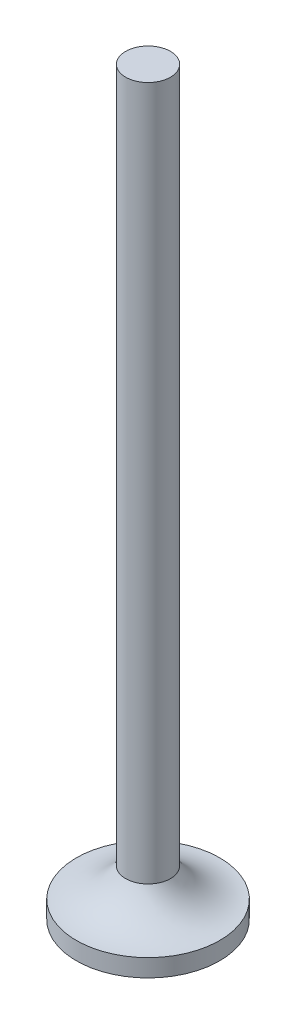
from build123d import *


with BuildPart() as part:
    # Sketch1 → Revolve1 (revolve)
    with BuildSketch(Plane.XY, mode=Mode.PRIVATE) as revolve1_sk:
        with BuildLine():
            Line((0, 0), (10.16, 0))
            Line((10.16, 0), (10.16, 2.5))
            ThreePointArc((10.16, 2.5), (6.110294408, 3.600733038), (3.175, 6.600028846))
            Line((3.175, 6.600028846), (3.175, 105))
            Line((3.175, 105), (0, 105))
            Line((0, 105), (0, 0))
        make_face()
    revolve(revolve1_sk.sketch.rotate(Axis((0, -31.831703756, 0), (0, 1, 0)), 90), axis=Axis((0, -31.831703756, 0), (0, 1, 0)))


solid = part.part
